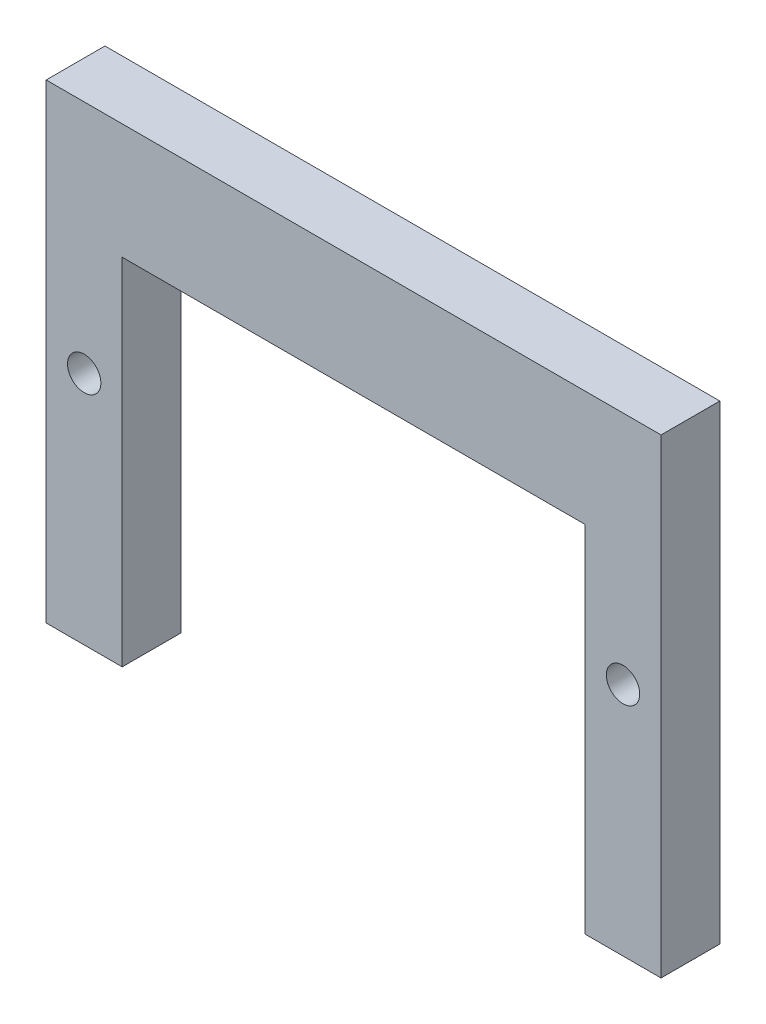
from build123d import *

# Parameters (mm, degrees)
SKETCH1_R           = 0.8509
BOSS_EXTRUDE1_DEPTH = 3


with BuildPart() as part:
    # Sketch1 → Boss-Extrude1 (new body)
    with BuildSketch(Plane.XY):
        Polygon((15.691, 24.0041), (-15.691, 24.0041), (-15.691, 0), (-11.811, 0), (-11.811, 18.1091), (11.811, 18.1091), (11.811, 0), (15.691, 0), align=None)
        with Locations((-13.751, 12.0021)):
            Circle(SKETCH1_R, mode=Mode.SUBTRACT)
        with Locations(Location((13.751, 12.0021, 0), (0, 0, 180))):
            Circle(SKETCH1_R, mode=Mode.SUBTRACT)
    extrude(amount=BOSS_EXTRUDE1_DEPTH)


solid = part.part
